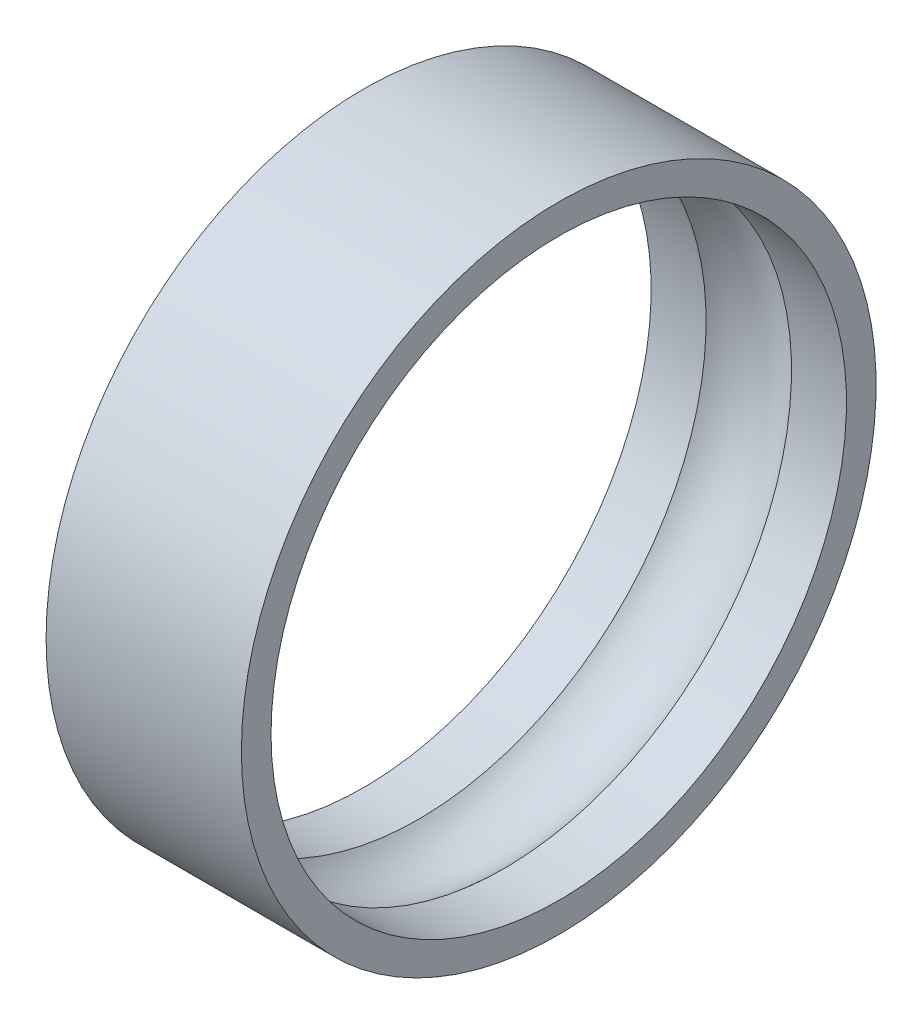
from build123d import *


with BuildPart() as part:
    # Esquisse1 → Révolution1 (revolve)
    with BuildSketch(Plane.XY, mode=Mode.PRIVATE) as r_volution1_sk:
        with BuildLine():
            ThreePointArc((-1.75, -1.785357107), (0, -2.5), (1.75, -1.785357107))
            Line((1.75, -1.785357107), (4, -1.785357107))
            Line((4, -1.785357107), (4, -3))
            Line((4, -3), (-4, -3))
            Line((-4, -3), (-4, -1.785357107))
            Line((-4, -1.785357107), (-1.75, -1.785357107))
        make_face()
    revolve(r_volution1_sk.sketch.rotate(Axis((-1011.100347617, 10, 0), (1, 0, 0)), 270), axis=Axis((-1011.100347617, 10, 0), (1, 0, 0)))


solid = part.part
